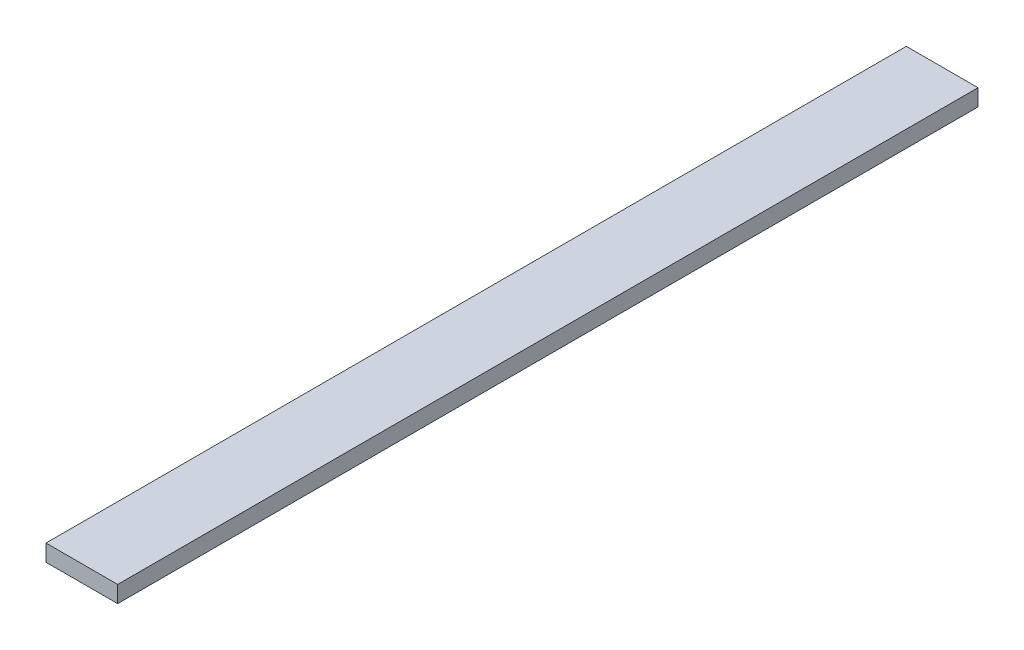
from build123d import *

# Parameters (mm, degrees)
BASE_SKETCH_W       = 50.8
BASE_SKETCH_H       = 609.6
BOSS_EXTRUDE1_DEPTH = 11.81


with BuildPart() as part:
    # Base_Sketch → Boss-Extrude1 (new body)
    with BuildSketch(Plane(origin=(0, 0, 0), x_dir=(1, 0, 0), z_dir=(0, 1, 0))):
        Rectangle(BASE_SKETCH_W, BASE_SKETCH_H)
    extrude(amount=BOSS_EXTRUDE1_DEPTH)


solid = part.part
